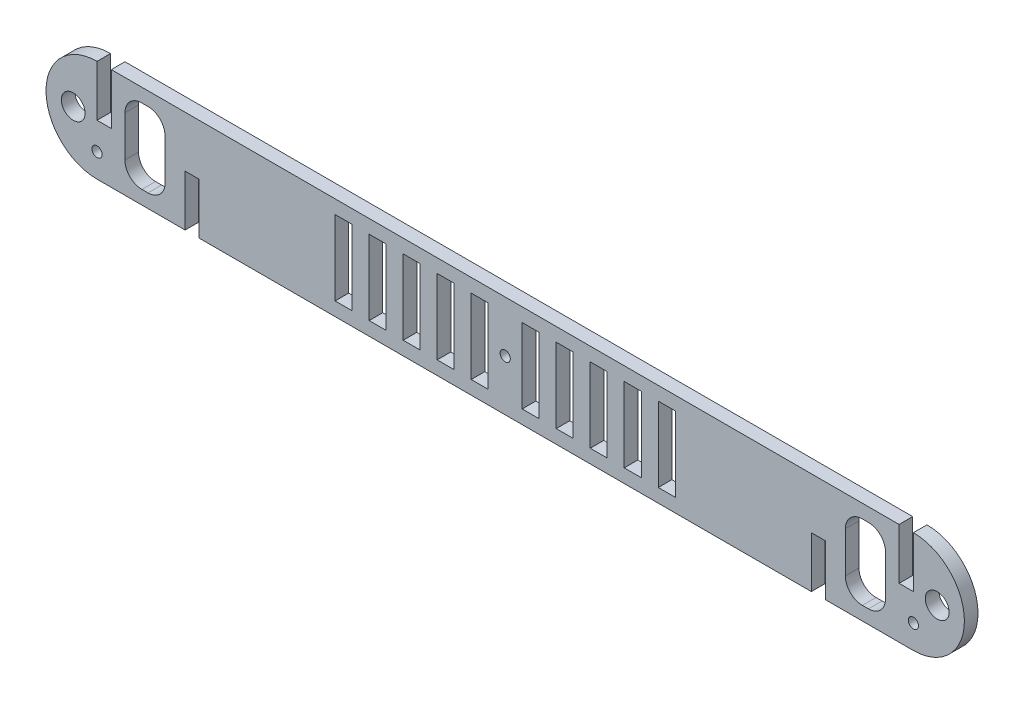
from build123d import *

# Parameters (mm, degrees)
EXTRUDE_1_DEPTH     = 2
SKETCH_11_W         = 4.2
SKETCH_11_H         = 15
SKETCH_11_W_2       = 46.8
SKETCH_11_H_2       = 22
SKETCH_11_W_3       = 5
SKETCH_11_R         = 3.5
SKETCH_11_R_2       = 1.5
CUT_EXTRUDE_1_DEPTH = 10
SKETCH_12_W         = 45
SKETCH_12_H         = 22
EXTRUDE_2_DEPTH     = 4
SKETCH_13_W         = 4.1
SKETCH_13_H         = 15
CUT_EXTRUDE_2_DEPTH = 136.889661123
FILLET_1_R          = 5


with BuildPart() as part:
    # Эскиз1 → Бобышка-Вытянуть1 (new, symmetric)
    with BuildSketch(Plane.XY):
        with BuildLine():
            Line((-120, 15), (120, 15))
            ThreePointArc((120, 15), (135, 0), (120, -15))
            Line((120, -15), (-120, -15))
            ThreePointArc((-120, -15), (-135, 0), (-120, 15))
        make_face()
    extrude(amount=EXTRUDE_1_DEPTH, both=True)

    # Эскиз11 → Вырез-Вытянуть1 (cut)
    with BuildSketch(Plane(origin=(0, 0, -2), x_dir=(-1, 0, 0), z_dir=(0, 0, -1))):
        with Locations((-117.9, 7.5)):
            Rectangle(SKETCH_11_W, SKETCH_11_H)
        with Locations((-88.4, 0)):
            Rectangle(SKETCH_11_W_2, SKETCH_11_H_2)
        with Locations((-57.5, 0)):
            Rectangle(SKETCH_11_W_3, SKETCH_11_H_2)
        with Locations((-47.5, 0)):
            Rectangle(SKETCH_11_W_3, SKETCH_11_H_2)
        with Locations((-37.5, 0)):
            Rectangle(SKETCH_11_W_3, SKETCH_11_H_2)
        with Locations((-27.5, 0)):
            Rectangle(SKETCH_11_W_3, SKETCH_11_H_2)
        with Locations((-17.5, 0)):
            Rectangle(SKETCH_11_W_3, SKETCH_11_H_2)
        with Locations((-7.5, 0)):
            Rectangle(SKETCH_11_W_3, SKETCH_11_H_2)
        with Locations((7.5, 0)):
            Rectangle(SKETCH_11_W_3, SKETCH_11_H_2)
        with Locations((17.5, 0)):
            Rectangle(SKETCH_11_W_3, SKETCH_11_H_2)
        with Locations((27.5, 0)):
            Rectangle(SKETCH_11_W_3, SKETCH_11_H_2)
        with Locations((37.5, 0)):
            Rectangle(SKETCH_11_W_3, SKETCH_11_H_2)
        with Locations((47.5, 0)):
            Rectangle(SKETCH_11_W_3, SKETCH_11_H_2)
        with Locations((57.5, 0)):
            Rectangle(SKETCH_11_W_3, SKETCH_11_H_2)
        with Locations((88.4, 0)):
            Rectangle(SKETCH_11_W_2, SKETCH_11_H_2)
        with Locations((117.9, 7.5)):
            Rectangle(SKETCH_11_W, SKETCH_11_H)
        with Locations((127, 0)):
            Circle(SKETCH_11_R)
        with Locations((-127, 0)):
            Circle(SKETCH_11_R)
        Circle(SKETCH_11_R_2)
        with Locations((-120, -8)):
            Circle(SKETCH_11_R_2)
        with Locations((120, -8)):
            Circle(SKETCH_11_R_2)
    extrude(amount=-CUT_EXTRUDE_1_DEPTH, mode=Mode.SUBTRACT)

    # Эскиз12 → Бобышка-Вытянуть2 (add)
    with BuildSketch(Plane.XY.offset(2)):
        with Locations((-77.5, 0)):
            Rectangle(SKETCH_12_W, SKETCH_12_H)
    extrude_2 = extrude(amount=-EXTRUDE_2_DEPTH)

    # Зеркальное отражение1: Бобышка-Вытянуть2 across plane
    add(extrude_2.mirror(Plane(origin=(0, 0, 0), x_dir=(0, 0, 1), z_dir=(1, 0, 0))))

    # Эскиз13 → Вырез-Вытянуть2 (cut, through all)
    with BuildSketch(Plane.XY.offset(2)):
        with Locations((-92.05, -7.5)):
            Rectangle(SKETCH_13_W, SKETCH_13_H)
    cut_extrude_2 = extrude(amount=-CUT_EXTRUDE_2_DEPTH, mode=Mode.SUBTRACT)

    # Зеркальное отражение2: Вырез-Вытянуть2 across plane
    add(cut_extrude_2.mirror(Plane(origin=(0, 0, 0), x_dir=(0, 0, 1), z_dir=(1, 0, 0))), mode=Mode.SUBTRACT)

    # Скругление1
    fillet_1_edges = [part.edges().sort_by_distance(p)[0] for p in [
        (-111.8, 11, 0),
        (-111.8, -11, 0),
        (-100, 11, 0),
        (-100, -11, 0),
        (100, -11, 0),
        (100, 11, 0),
        (111.8, -11, 0),
        (111.8, 11, 0),
    ]]
    fillet(fillet_1_edges, radius=FILLET_1_R)


solid = part.part
